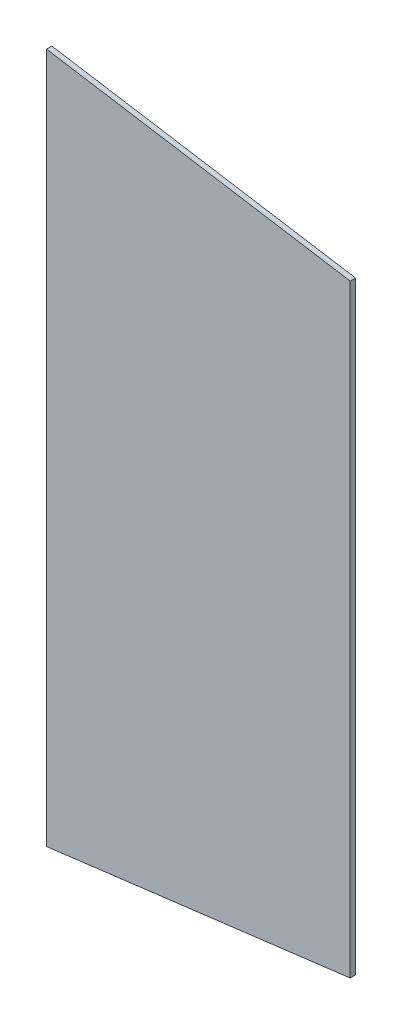
from build123d import *

# Parameters (mm, degrees)
BOSS_EXTRUDE1_DEPTH = 2


with BuildPart() as part:
    # Sketch1 → Boss-Extrude1 (new body)
    with BuildSketch(Plane.XY):
        Polygon((-69.714285714, 63.028269367), (-69.714285714, -163.484435563), (-183.714285714, -177.734435563), (-183.714285714, 81.439981395), align=None)
    extrude(amount=BOSS_EXTRUDE1_DEPTH)


solid = part.part
